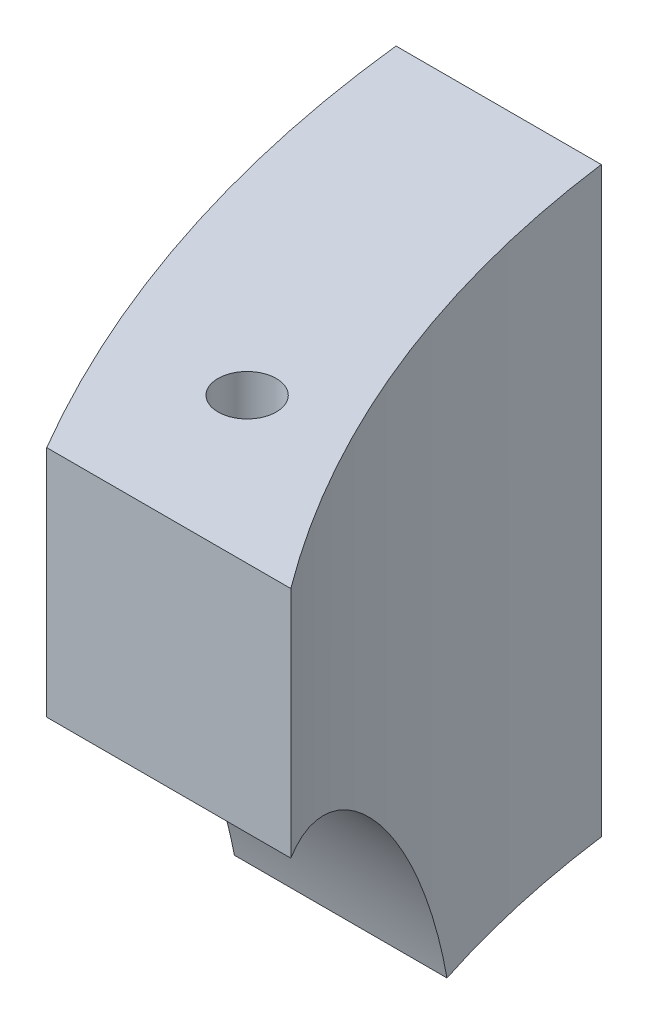
from build123d import *

# Parameters (mm, degrees)
BOSS_EXTRUDE1_DEPTH      = 60
SKETCH25_W               = 5.5
SKETCH25_H               = 17
BOSS_EXTRUDE3_DEPTH      = 20
FILLET1_R                = 2.3
SKETCH28_W               = 8
SKETCH28_H               = 10
CUT_EXTRUDE17_DEPTH      = 265
CUT_EXTRUDE19_DEPTH      = 165.638713704
CUT_EXTRUDE19_DEPTH_BACK = 165.638713704
SKETCH30_W               = 183.61
SKETCH30_H               = 30
CUT_EXTRUDE20_DEPTH      = 165.638713704
CUT_EXTRUDE20_DEPTH_BACK = 165.638713704
SKETCH32_W               = 3
SKETCH32_H               = 14
BOSS_EXTRUDE4_DEPTH      = 40
CUT_EXTRUDE21_DEPTH      = 90
CUT_EXTRUDE22_DEPTH      = 164.320868502
CUT_EXTRUDE22_DEPTH_BACK = 164.320868502
SKETCH39_R               = 2
CUT_EXTRUDE23_DEPTH      = 88
SKETCH40_R               = 2
CUT_EXTRUDE24_DEPTH      = 88


with BuildPart() as part:
    # Sketch1 → Boss-Extrude1 (new body)
    with BuildSketch(Plane(origin=(0, 0, 0), x_dir=(1, 0, 0), z_dir=(0, 1, 0))):
        with BuildLine():
            Line((91.805, -10), (90.252689849, -10))
            ThreePointArc((90.252689849, -10), (0, -90.805), (-90.252689849, -10))
            Line((-90.252689849, -10), (-91.805, -10))
            Line((-91.805, -10), (-91.805, 20))
            Line((-91.805, 20), (-76.805, 20))
            Line((-76.805, 20), (-76.805, 0))
            ThreePointArc((-76.805, 0), (0, -76.805), (76.805, 0))
            Line((76.805, 0), (76.805, 20))
            Line((76.805, 20), (91.805, 20))
            Line((91.805, 20), (91.805, -10))
        make_face()
    extrude(amount=-BOSS_EXTRUDE1_DEPTH)

    # Sketch25 → Boss-Extrude3 (add)
    with BuildSketch(Plane(origin=(0, -60, 0), x_dir=(-1, 0, 0), z_dir=(0, -1, 0))):
        with Locations((84.305, 5)):
            Rectangle(SKETCH25_W, SKETCH25_H)
        with Locations((-84.305, 5)):
            Rectangle(SKETCH25_W, SKETCH25_H)
    extrude(amount=BOSS_EXTRUDE3_DEPTH)

    # Fillet1
    fillet1_edges = [part.edges().sort_by_distance(p)[0] for p in [
        (84.305, -60, 3.5),
        (81.555, -60, -5),
        (87.055, -60, -5),
        (84.305, -60, -13.5),
        (-84.305, -60, 3.5),
        (-87.055, -60, -5),
        (-81.555, -60, -5),
        (-84.305, -60, -13.5),
    ]]
    fillet(fillet1_edges, radius=FILLET1_R)

    # Sketch28 → Cut-Extrude17 (cut)
    with BuildSketch(Plane(origin=(91.805, 0, 0), x_dir=(0, 0, -1), z_dir=(1, 0, 0))):
        with Locations((5, -42)):
            Rectangle(SKETCH28_W, SKETCH28_H)
    extrude(amount=-CUT_EXTRUDE17_DEPTH, mode=Mode.SUBTRACT)

    # Sketch30 → Cut-Extrude19 (cut, two sides: drawn at the far end of the back side and taken through both)
    with BuildSketch(Plane(origin=(0, 0, -20), x_dir=(-1, 0, 0), z_dir=(0, 0, -1)).offset(-CUT_EXTRUDE19_DEPTH_BACK)):
        with Locations((0, -15)):
            Rectangle(SKETCH30_W, SKETCH30_H)
    extrude(amount=CUT_EXTRUDE19_DEPTH + CUT_EXTRUDE19_DEPTH_BACK, mode=Mode.SUBTRACT)

    # Sketch32 → Cut-Extrude20 (cut, two sides: drawn at the far end of the back side and taken through both)
    with BuildSketch(Plane(origin=(0, 0, -20), x_dir=(-1, 0, 0), z_dir=(0, 0, -1)).offset(-CUT_EXTRUDE20_DEPTH_BACK)):
        with Locations((-65.13523483, -44)):
            Rectangle(SKETCH32_W, SKETCH32_H)
        with Locations((-51.773928511, -44)):
            Rectangle(SKETCH32_W, SKETCH32_H)
        with Locations((-84.305, -46)):
            Rectangle(SKETCH32_W, SKETCH32_H)
        with Locations((65.13523483, -44)):
            Rectangle(SKETCH32_W, SKETCH32_H)
        with Locations((51.773928511, -44)):
            Rectangle(SKETCH32_W, SKETCH32_H)
        with Locations((84.305, -46)):
            Rectangle(SKETCH32_W, SKETCH32_H)
    extrude(amount=CUT_EXTRUDE20_DEPTH + CUT_EXTRUDE20_DEPTH_BACK, mode=Mode.SUBTRACT)

    # Sketch33 → Boss-Extrude4 (add)
    with BuildSketch(Plane(origin=(0, -60, 0), x_dir=(-1, 0, 0), z_dir=(0, -1, 0))):
        with BuildLine():
            Line((90.252689849, -10), (76.151218145, -10))
            ThreePointArc((76.151218145, -10), (71.169996018, -28.876282513), (61.590580503, -45.886909008))
            Line((61.590580503, -45.886909008), (73.898492454, -52.768938193))
            ThreePointArc((73.898492454, -52.768938193), (84.815671791, -32.432234638), (90.252689849, -10))
        make_face()
    extrude(amount=BOSS_EXTRUDE4_DEPTH)

    # Sketch37 → Cut-Extrude21 (cut)
    with BuildSketch(Plane(origin=(0, 0, 0), x_dir=(0, 0, -1), z_dir=(1, 0, 0))):
        with BuildLine():
            Line((-0.881303102, -100), (-23.690614963, -100))
            ThreePointArc((-23.690614963, -100), (-31.684760451, -85.14357588), (-45.886909008, -76.037606625))
            Line((-45.886909008, -76.037606625), (-45.886909008, -59.917167305))
            Line((-45.886909008, -59.917167305), (-66.948234535, -59.917167305))
            Line((-66.948234535, -59.917167305), (-63.746381293, -92.441906362))
            Line((-63.746381293, -92.441906362), (-47.571757556, -115.346464391))
            Line((-47.571757556, -115.346464391), (-8.086377987, -115.346464391))
            Line((-8.086377987, -115.346464391), (-0.881303102, -100))
        make_face()
    extrude(amount=-CUT_EXTRUDE21_DEPTH, mode=Mode.SUBTRACT)

    # Sketch38 → Cut-Extrude22 (cut, two sides: drawn at the far end of the back side and taken through both)
    with BuildSketch(Plane(origin=(0, 0, 0), x_dir=(0, 0, -1), z_dir=(1, 0, 0)).offset(-CUT_EXTRUDE22_DEPTH_BACK)):
        Polygon((20, -30), (-90.805, -30), (-90.805, -60), (-10, -60), (-10, -100), (20, -100), (20, -60), align=None)
    extrude(amount=CUT_EXTRUDE22_DEPTH + CUT_EXTRUDE22_DEPTH_BACK, mode=Mode.SUBTRACT)

    # Sketch39 → Cut-Extrude23 (cut)
    with BuildSketch(Plane(origin=(0, 0, 10), x_dir=(-1, 0, 0), z_dir=(0, 0, -1))):
        with Locations((82.252689849, -87.5)):
            Circle(SKETCH39_R)
    extrude(amount=-CUT_EXTRUDE23_DEPTH, mode=Mode.SUBTRACT)

    # Sketch40 → Cut-Extrude24 (cut)
    with BuildSketch(Plane(origin=(0, -60, 0), x_dir=(1, 0, 0), z_dir=(0, 1, 0))):
        with Locations(Location((-74.590580503, -35.886909008, 0), (0, 0, 270))):
            Circle(SKETCH40_R)
    extrude(amount=-CUT_EXTRUDE24_DEPTH, mode=Mode.SUBTRACT)


solid = part.part
